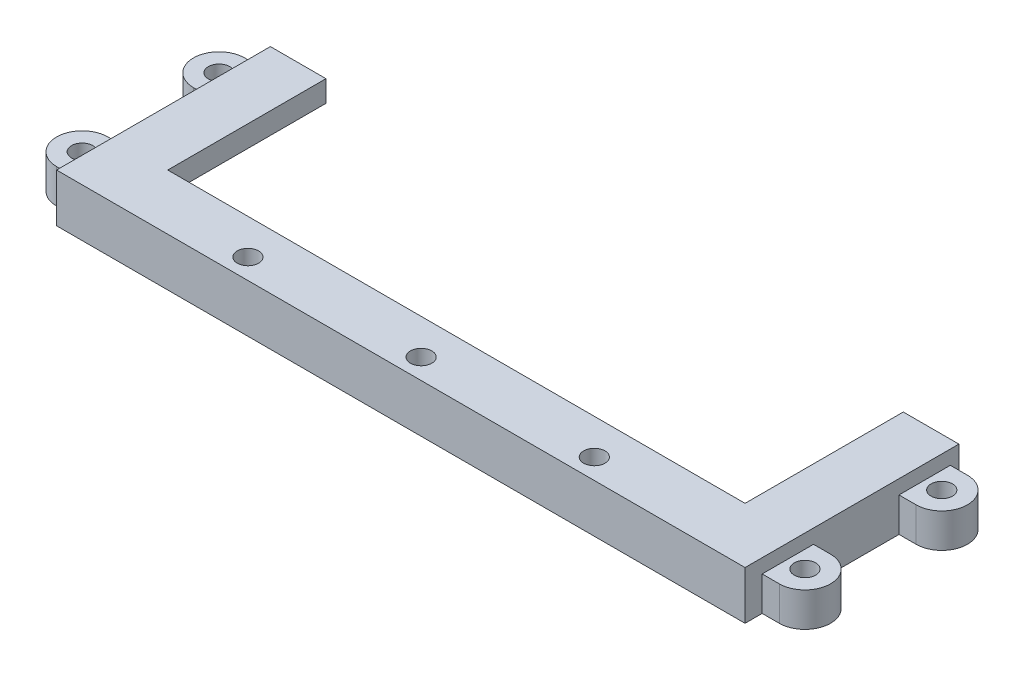
from build123d import *

# Parameters (mm, degrees)
CROQUIS4_W                = 13
CROQUIS4_H                = 11.3
SALIENTE_EXTRUIR1_DEPTH   = 161
CROQUIS5_W                = 151
CROQUIS5_H                = 3.5
CORTAR_EXTRUIR1_DEPTH     = 6.3
SALIENTE_EXTRUIR3_DEPTH   = 8
CROQUIS9_R                = 2.5
CORTAR_EXTRUIR3_DEPTH     = 179.518038304
SIMETR_A8_COPY_1_DEPTH    = 8
SIMETR_A8_COPY_2_SKETCH_R = 2.5
SIMETR_A8_COPY_2_DEPTH    = 179.518038304
CROQUIS10_R               = 2.5
CORTAR_EXTRUIR4_DEPTH     = 179.518038304
MATRIZL1_COUNT            = 3
MATRIZL1_PITCH            = 40.5


with BuildPart() as part:
    # Barrer1: sweep along a path in Croquis3
    with BuildLine(Plane(origin=(0, 0, 0), x_dir=(1, 0, 0), z_dir=(0, 1, 0))) as barrer1_path:
        Line((0, 0), (0, -37))
    # Croquis1 → Barrer1 (sweep)
    with BuildSketch(Plane.XY):
        Polygon((0, 0), (0, 11.3), (13, 11.3), (13, 6.3), (5, 6.3), (5, 0), align=None)
    barrer1 = sweep(path=barrer1_path.line)

    # Croquis4 → Saliente-Extruir1 (add)
    with BuildSketch(Plane.ZY):
        with Locations((43.5, 5.65)):
            Rectangle(CROQUIS4_W, CROQUIS4_H)
    extrude(amount=-SALIENTE_EXTRUIR1_DEPTH)

    # Simetría5: Barrer1 across plane
    add(barrer1.mirror(Plane.ZY.offset(-80.5)))

    # Croquis5 → Cortar-Extruir1 (cut)
    with BuildSketch(Plane.XZ):
        with Locations((80.5, 38.75)):
            Rectangle(CROQUIS5_W, CROQUIS5_H)
    extrude(amount=-CORTAR_EXTRUIR1_DEPTH, mode=Mode.SUBTRACT)

    # Croquis8 → Saliente-Extruir3 (add)
    with BuildSketch(Plane.XZ):
        with BuildLine():
            Line((161, 46), (165, 46))
            ThreePointArc((165, 46), (171, 40), (165, 34))
            Line((165, 34), (161, 34))
            Line((161, 34), (161, 46))
        make_face()
    saliente_extruir3 = extrude(amount=-SALIENTE_EXTRUIR3_DEPTH)

    # Croquis9 → Cortar-Extruir3 (cut, through all)
    with BuildSketch(Plane.XZ):
        with Locations((165, 40)):
            Circle(CROQUIS9_R)
    cortar_extruir3 = extrude(amount=-CORTAR_EXTRUIR3_DEPTH, mode=Mode.SUBTRACT)

    # Simetría7: Saliente-Extruir3, Cortar-Extruir3 across plane
    add(saliente_extruir3.mirror(Plane(origin=(0, 0, 24), x_dir=(1, 0, 0), z_dir=(0, 0, -1))))
    add(cortar_extruir3.mirror(Plane(origin=(0, 0, 24), x_dir=(1, 0, 0), z_dir=(0, 0, -1))), mode=Mode.SUBTRACT)

    # Simetría8: Saliente-Extruir3, Cortar-Extruir3 across plane
    add(saliente_extruir3.mirror(Plane.ZY.offset(-80.5)))
    add(cortar_extruir3.mirror(Plane.ZY.offset(-80.5)), mode=Mode.SUBTRACT)

    # Simetría8 copy 1 sketch → Simetría8 copy 1 (add)
    with BuildSketch(Plane(origin=(161, 0, 48), x_dir=(-1, 0, 0), z_dir=(0, -1, 0))):
        with BuildLine():
            Line((161, 46), (165, 46))
            ThreePointArc((165, 46), (171, 40), (165, 34))
            Line((165, 34), (161, 34))
            Line((161, 34), (161, 46))
        make_face()
    extrude(amount=-SIMETR_A8_COPY_1_DEPTH)

    # Simetría8 copy 2 sketch → Simetría8 copy 2 (cut, through all)
    with BuildSketch(Plane(origin=(161, 0, 48), x_dir=(-1, 0, 0), z_dir=(0, -1, 0))):
        with Locations((165, 40)):
            Circle(SIMETR_A8_COPY_2_SKETCH_R)
    extrude(amount=-SIMETR_A8_COPY_2_DEPTH, mode=Mode.SUBTRACT)

    # Croquis10 → Cortar-Extruir4 (cut, through all)
    with BuildSketch(Plane(origin=(0, 11.3, 0), x_dir=(1, 0, 0), z_dir=(0, 1, 0))):
        with Locations(Location((121, -45.25, 0), (0, 0, 270))):
            Circle(CROQUIS10_R)
    cortar_extruir4 = extrude(amount=-CORTAR_EXTRUIR4_DEPTH, mode=Mode.SUBTRACT)

    # MatrizL1: Cortar-Extruir4 ×3
    with Locations(*[(-i * MATRIZL1_PITCH, 0, 0) for i in range(1, MATRIZL1_COUNT)]):
        add(cortar_extruir4, mode=Mode.SUBTRACT)


solid = part.part
